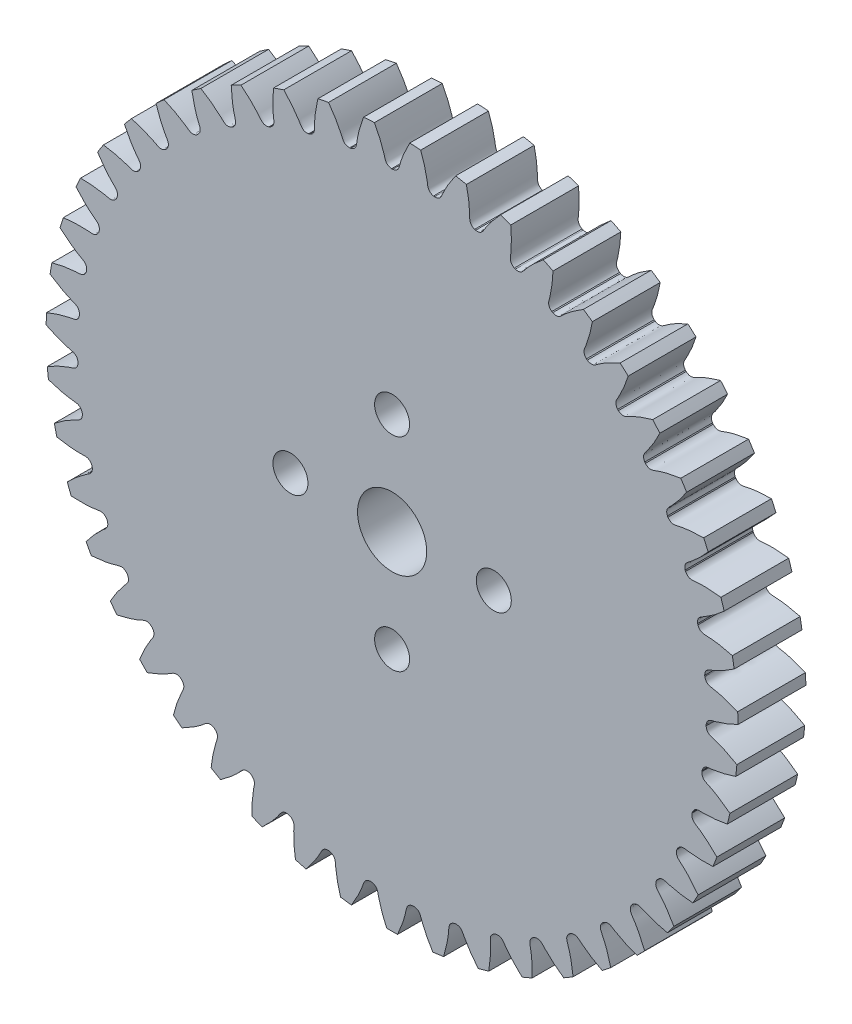
from build123d import *

# Parameters (mm, degrees)
SKETCH_1_R               = 30.625
EXTRUDE_1_DEPTH          = 6
CUT_EXTRUDE_1_DEPTH      = 6
PATTERN_CIRCULAR_1_COUNT = 47
SKETCH_4_R               = 1.55
SKETCH_4_R_2             = 3.06
CUT_EXTRUDE_2_DEPTH      = 6


with BuildPart() as part:
    # 草图1 → 凸台-拉伸1 (new body)
    with BuildSketch(Plane.XY):
        Circle(SKETCH_1_R)
    extrude(amount=EXTRUDE_1_DEPTH)

    # 草图2 → 切除-拉伸1 (cut)
    with BuildSketch(Plane.XY):
        with BuildLine():
            ThreePointArc((0.048148053, 27.812458324), (0, 27.8125), (-0.048148053, 27.812458324))
            add(Edge.make_bspline(
                [(-0.048148053, 27.812458324), (-0.549798296, 27.878938347), (-0.609993687, 28.254238821), (-0.732804646, 28.662061717), (-0.781460244, 28.814836462), (-0.836894311, 28.976963085), (-0.899285065, 29.148353378), (-0.969086835, 29.32875259), (-1.04666478, 29.517939655), (-1.132402049, 29.715668427), (-1.226667987, 29.921685104), (-1.329826999, 30.135723364), (-1.442235585, 30.357506011), (-1.564242802, 30.586744737), (-1.696189752, 30.82314044), (-1.838409346, 31.066383391), (-1.991226002, 31.316153454), (-2.154955371, 31.5721203), (-2.329904051, 31.833943634), (-2.516369323, 32.101273425), (-2.714638882, 32.373750142), (-2.924990576, 32.651005002), (-3.147692155, 32.93266022), (-3.383001017, 33.218329267), (-3.631163991, 33.507617133), (-3.892416996, 33.800120603), (-4.263520459, 34.199255577), (-4.554742854, 34.493983172), (-4.755273356, 34.689179121)],
                knots=[0, 0, 0, 0, 0.114836158, 0.132524592, 0.151521532, 0.171826979, 0.193440931, 0.216363391, 0.240594356, 0.266133828, 0.292981806, 0.321138291, 0.350603282, 0.381376779, 0.413458783, 0.446849293, 0.481548309, 0.517555832, 0.554871861, 0.593496396, 0.633429438, 0.674670986, 0.71722104, 0.761079601, 0.806246668, 0.852722241, 0.900506321, 1, 1, 1, 1], degree=3))
            ThreePointArc((-4.755273356, 34.689179121), (0, 35.013594114), (4.755273356, 34.689179121))
            add(Edge.make_bspline(
                [(0.048148053, 27.812458324), (0.549798296, 27.878938347), (0.609993687, 28.254238821), (0.732804646, 28.662061717), (0.781460244, 28.814836462), (0.836894311, 28.976963085), (0.899285065, 29.148353378), (0.969086835, 29.32875259), (1.04666478, 29.517939655), (1.132402049, 29.715668427), (1.226667987, 29.921685104), (1.329826999, 30.135723364), (1.442235585, 30.357506011), (1.564242802, 30.586744737), (1.696189752, 30.82314044), (1.838409346, 31.066383391), (1.991226002, 31.316153454), (2.154955371, 31.5721203), (2.329904051, 31.833943634), (2.516369323, 32.101273425), (2.714638882, 32.373750142), (2.924990576, 32.651005002), (3.147692155, 32.93266022), (3.383001017, 33.218329267), (3.631163991, 33.507617133), (3.892416996, 33.800120603), (4.263520459, 34.199255577), (4.554742854, 34.493983172), (4.755273356, 34.689179121)],
                knots=[0, 0, 0, 0, 0.114836158, 0.132524592, 0.151521532, 0.171826979, 0.193440931, 0.216363391, 0.240594356, 0.266133828, 0.292981806, 0.321138291, 0.350603282, 0.381376779, 0.413458783, 0.446849293, 0.481548309, 0.517555832, 0.554871861, 0.593496396, 0.633429438, 0.674670986, 0.71722104, 0.761079601, 0.806246668, 0.852722241, 0.900506321, 1, 1, 1, 1], degree=3))
        make_face()
    cut_extrude_1 = extrude(amount=CUT_EXTRUDE_1_DEPTH, mode=Mode.SUBTRACT)

    # 阵列(圆周)1: 切除-拉伸1 ×47 about axis
    pattern_circular_1_axis = Axis((0, 0, -33.6875), (0, 0, 1))
    for i in range(1, PATTERN_CIRCULAR_1_COUNT):
        add(cut_extrude_1.rotate(pattern_circular_1_axis, i * 360 / PATTERN_CIRCULAR_1_COUNT), mode=Mode.SUBTRACT)

    # 草图4 → 切除-拉伸2 (cut)
    with BuildSketch(Plane.XY.offset(6)):
        with Locations((0, 9)):
            Circle(SKETCH_4_R)
        with Locations((9, 0)):
            Circle(SKETCH_4_R)
        with Locations((0, -9)):
            Circle(SKETCH_4_R)
        with Locations((-9, 0)):
            Circle(SKETCH_4_R)
        Circle(SKETCH_4_R_2)
    extrude(amount=-CUT_EXTRUDE_2_DEPTH, mode=Mode.SUBTRACT)


solid = part.part
